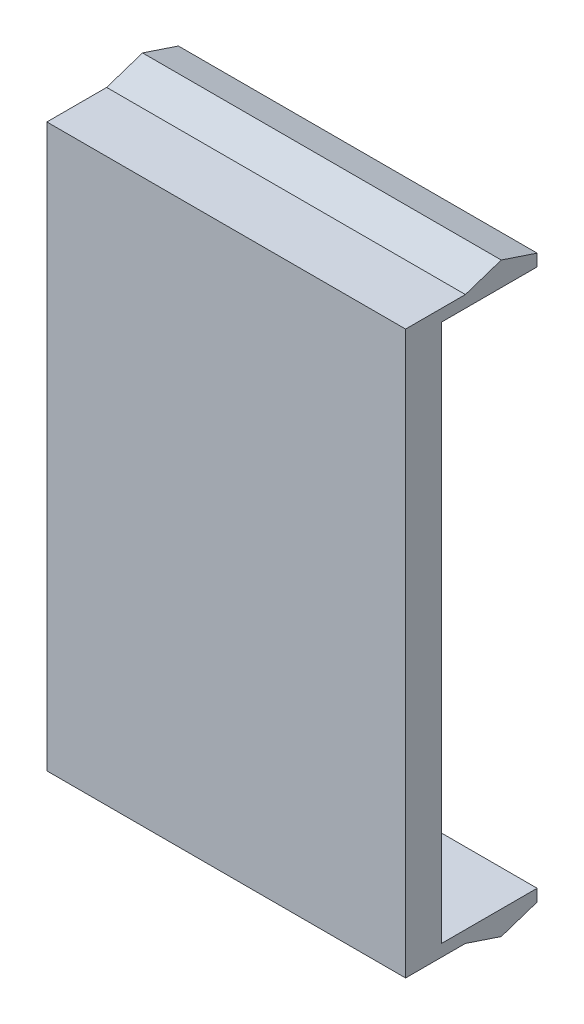
from build123d import *

# Parameters (mm, degrees)
SKETCH_1_W      = 30
SKETCH_1_H      = 47
EXTRUDE_1_DEPTH = 3
SKETCH_2_W      = 30
SKETCH_2_H      = 1
EXTRUDE_2_DEPTH = 8
EXTRUDE_3_DEPTH = 30


with BuildPart() as part:
    # 草图1 → 凸台-拉伸1 (new body)
    with BuildSketch(Plane.XY):
        Rectangle(SKETCH_1_W, SKETCH_1_H)
    extrude(amount=EXTRUDE_1_DEPTH)

    # 草图2 → 凸台-拉伸2 (add)
    with BuildSketch(Plane(origin=(0, 0, 0), x_dir=(-1, 0, 0), z_dir=(0, 0, -1))):
        with Locations((0, 23)):
            Rectangle(SKETCH_2_W, SKETCH_2_H)
        with Locations((0, -23)):
            Rectangle(SKETCH_2_W, SKETCH_2_H)
    extrude(amount=EXTRUDE_2_DEPTH)

    # 草图3 → 凸台-拉伸3 (add, through all)
    with BuildSketch(Plane(origin=(15, 0, 0), x_dir=(0, 0, -1), z_dir=(1, 0, 0))):
        Polygon((2, 23.5), (8, 23.5), (5, 24.5), align=None)
        Polygon((8, -23.5), (2, -23.5), (5, -24.5), align=None)
    extrude(amount=-EXTRUDE_3_DEPTH)


solid = part.part
